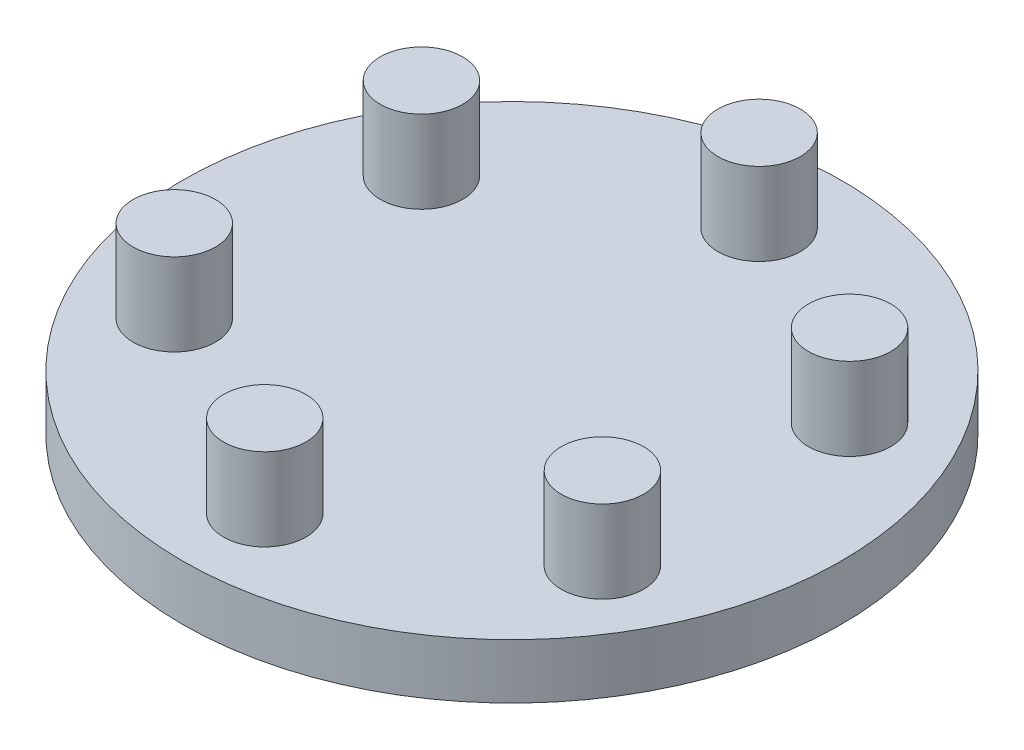
from build123d import *

# Parameters (mm, degrees)
ESQUISSE1_R                  = 60
BOSS_EXTRU_1_DEPTH           = 10
ESQUISSE2_R                  = 7.5
BOSS_EXTRU_2_DEPTH           = 15
R_P_TITION_CIRCULAIRE1_COUNT = 6


with BuildPart() as part:
    # Esquisse1 → Boss.-Extru.1 (new body)
    with BuildSketch(Plane(origin=(0, 0, 0), x_dir=(1, 0, 0), z_dir=(0, 1, 0))):
        with Locations(Location((0, 0, 0), (0, 0, 270))):
            Circle(ESQUISSE1_R)
    extrude(amount=BOSS_EXTRU_1_DEPTH)

    # Esquisse2 → Boss.-Extru.2 (add)
    with BuildSketch(Plane(origin=(0, 10, 0), x_dir=(1, 0, 0), z_dir=(0, 1, 0))):
        with Locations(Location((0, 45, 0), (0, 0, 270))):
            Circle(ESQUISSE2_R)
    boss_extru_2 = extrude(amount=BOSS_EXTRU_2_DEPTH)

    # Répétition circulaire1: Boss.-Extru.2 ×6 about axis
    r_p_tition_circulaire1_axis = Axis((0, 0, 0), (0, 1, 0))
    for i in range(1, R_P_TITION_CIRCULAIRE1_COUNT):
        add(boss_extru_2.rotate(r_p_tition_circulaire1_axis, i * 360 / R_P_TITION_CIRCULAIRE1_COUNT))


solid = part.part
